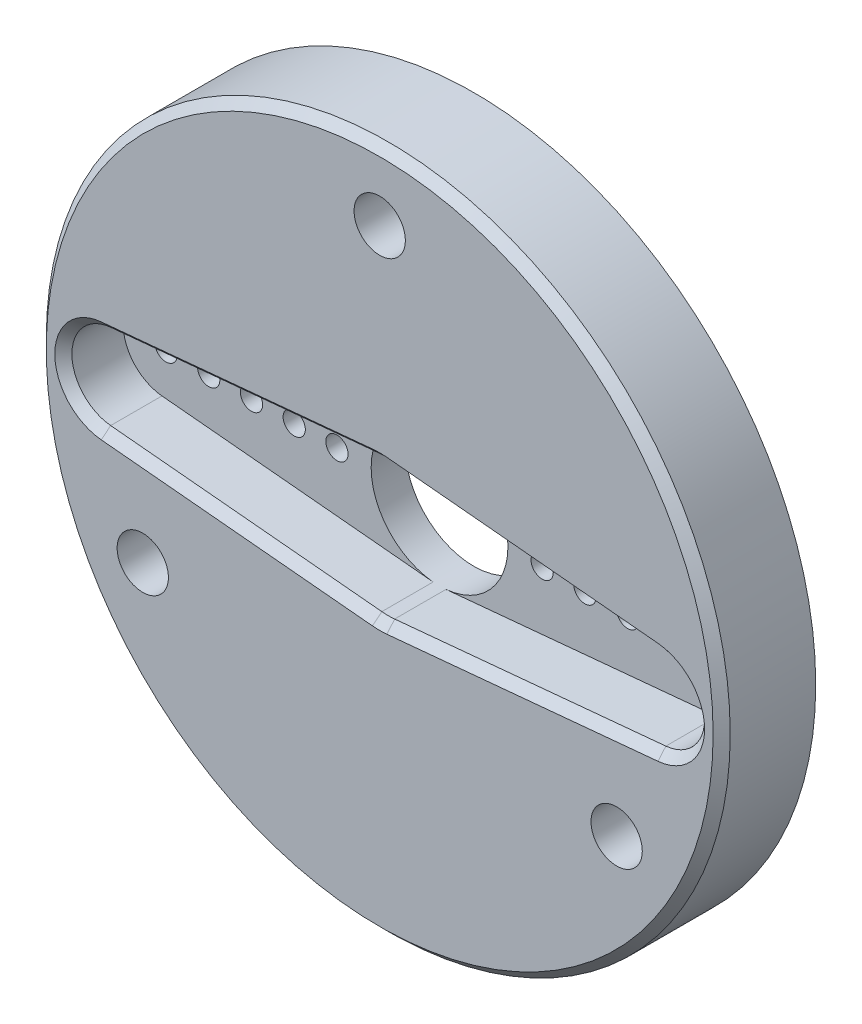
from build123d import *

# Parameters (mm, degrees)
SKETCH_1_R          = 20
SKETCH_1_R_2        = 4
SKETCH_1_R_3        = 0.65
EXTRUDE_1_DEPTH     = 5.5
CUT_EXTRUDE_START   = -3.5
CUT_EXTRUDE_1_DEPTH = 3.5
SKETCH_3_R          = 1.5
CUT_EXTRUDE_2_DEPTH = 13
CHAMFER_1_SIZE      = 0.5
CHAMFER_2_SIZE      = 0.5


with BuildPart() as part:
    # 草图1 → 凸台-拉伸1 (new body)
    with BuildSketch(Plane.XY):
        Circle(SKETCH_1_R)
        Circle(SKETCH_1_R_2, mode=Mode.SUBTRACT)
        with Locations((6, 0)):
            Circle(SKETCH_1_R_3, mode=Mode.SUBTRACT)
        with Locations((8.5, 0)):
            Circle(SKETCH_1_R_3, mode=Mode.SUBTRACT)
        with Locations((11, 0)):
            Circle(SKETCH_1_R_3, mode=Mode.SUBTRACT)
        with Locations((13.5, 0)):
            Circle(SKETCH_1_R_3, mode=Mode.SUBTRACT)
        with Locations((16, 0)):
            Circle(SKETCH_1_R_3, mode=Mode.SUBTRACT)
        with Locations(Location((-16, 0, 0), (0, 0, 180))):
            Circle(SKETCH_1_R_3, mode=Mode.SUBTRACT)
        with Locations(Location((-13.5, 0, 0), (0, 0, 180))):
            Circle(SKETCH_1_R_3, mode=Mode.SUBTRACT)
        with Locations(Location((-11, 0, 0), (0, 0, 180))):
            Circle(SKETCH_1_R_3, mode=Mode.SUBTRACT)
        with Locations(Location((-8.5, 0, 0), (0, 0, 180))):
            Circle(SKETCH_1_R_3, mode=Mode.SUBTRACT)
        with Locations(Location((-6, 0, 0), (0, 0, 180))):
            Circle(SKETCH_1_R_3, mode=Mode.SUBTRACT)
    extrude(amount=EXTRUDE_1_DEPTH)

    # 草图2 → 切除-拉伸1 (cut)
    with BuildSketch(Plane.XY.offset(5.5).offset(CUT_EXTRUDE_START)):
        with BuildLine():
            Line((-16.234375, 2.488989425), (-0.375, 3.982383081))
            ThreePointArc((-0.375, 3.982383081), (0, 4), (0.375, 3.982383081))
            Line((0.375, 3.982383081), (16.234375, 2.488989425))
            ThreePointArc((16.234375, 2.488989425), (18.5, 0), (16.234375, -2.488989425))
            Line((16.234375, -2.488989425), (0.375, -3.982383081))
            ThreePointArc((0.375, -3.982383081), (0, -4), (-0.375, -3.982383081))
            Line((-0.375, -3.982383081), (-16.234375, -2.488989425))
            ThreePointArc((-16.234375, -2.488989425), (-18.5, 0), (-16.234375, 2.488989425))
        make_face()
    extrude(amount=CUT_EXTRUDE_1_DEPTH, mode=Mode.SUBTRACT)

    # 草图3 → 切除-拉伸2 (cut)
    with BuildSketch(Plane.XY.offset(5.5)):
        with Locations((0, 16)):
            Circle(SKETCH_3_R)
        with Locations((13.856406461, -8)):
            Circle(SKETCH_3_R)
        with Locations((-13.856406461, -8)):
            Circle(SKETCH_3_R)
    extrude(amount=-CUT_EXTRUDE_2_DEPTH, mode=Mode.SUBTRACT)

    # 倒角1
    chamfer_1_edges = [part.edges().sort_by_distance(p)[0] for p in [
        (-20, 0, 5.5),
    ]]
    chamfer(chamfer_1_edges, length=CHAMFER_1_SIZE)

    # 倒角2
    chamfer_2_edges = [part.edges().sort_by_distance(p)[0] for p in [
        (0, 4, 5.5),
        (0, -4, 5.5),
        (-8.3046875, 3.235686253, 5.5),
        (-18.5, 0, 5.5),
        (-8.3046875, -3.235686253, 5.5),
        (8.3046875, -3.235686253, 5.5),
        (18.5, 0, 5.5),
        (8.3046875, 3.235686253, 5.5),
    ]]
    chamfer(chamfer_2_edges, length=CHAMFER_2_SIZE)


solid = part.part
